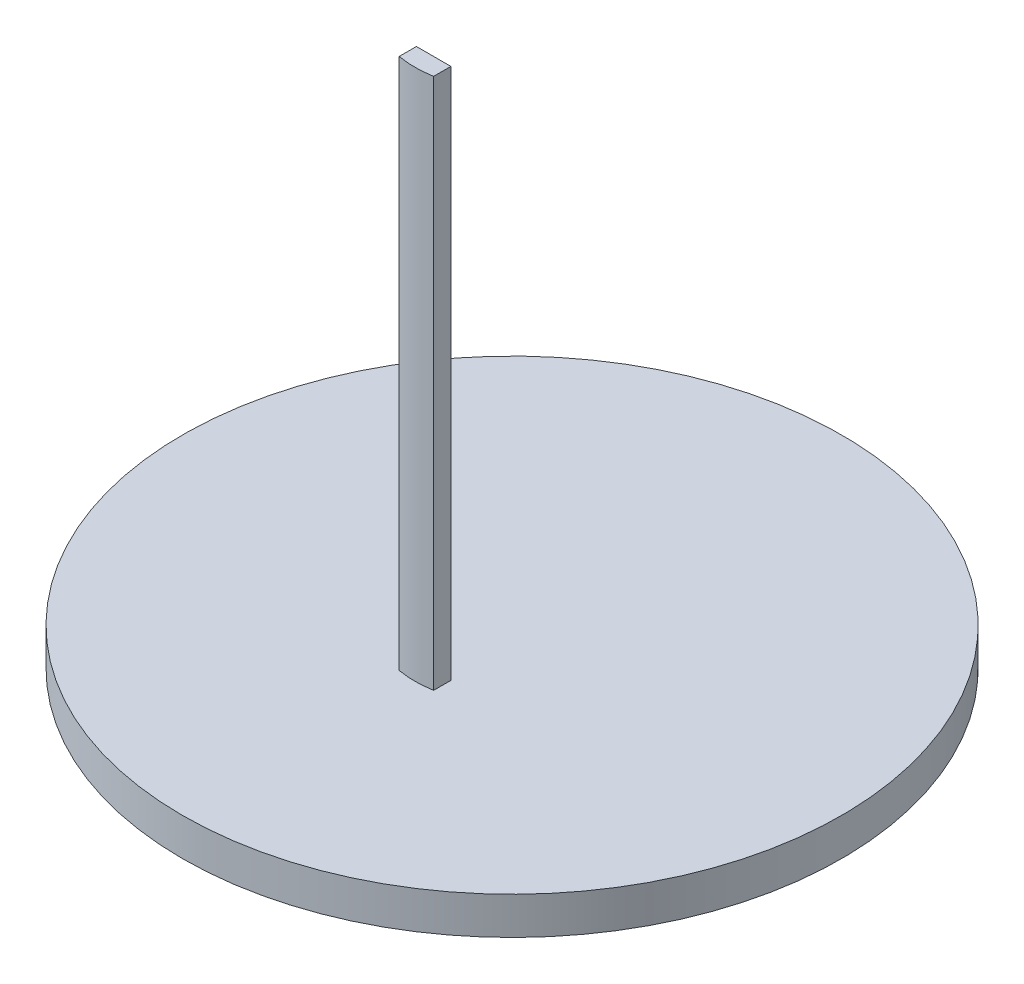
from build123d import *

# Parameters (mm, degrees)
SKETCH1_R           = 88.009986391
BOSS_EXTRUDE1_DEPTH = 10
BOSS_EXTRUDE5_DEPTH = 142


with BuildPart() as part:
    # Sketch1 → Boss-Extrude1 (new body)
    with BuildSketch(Plane(origin=(0, 0, 0), x_dir=(1, 0, 0), z_dir=(0, 1, 0))):
        with Locations(Location((0, 0, 0), (0, 0, 270))):
            Circle(SKETCH1_R)
    extrude(amount=BOSS_EXTRUDE1_DEPTH)

    # Sketch3 → Boss-Extrude5 (add)
    with BuildSketch(Plane(origin=(0, 10, 0), x_dir=(1, 0, 0), z_dir=(0, 1, 0))):
        with BuildLine():
            Line((-4.6, -20.945), (-4.6, -25.549199596))
            ThreePointArc((-4.6, -25.549199596), (0, -25.96), (4.6, -25.549199596))
            Line((4.6, -25.549199596), (4.6, -20.945))
            Line((4.6, -20.945), (-4.6, -20.945))
        make_face()
    extrude(amount=BOSS_EXTRUDE5_DEPTH)


solid = part.part
